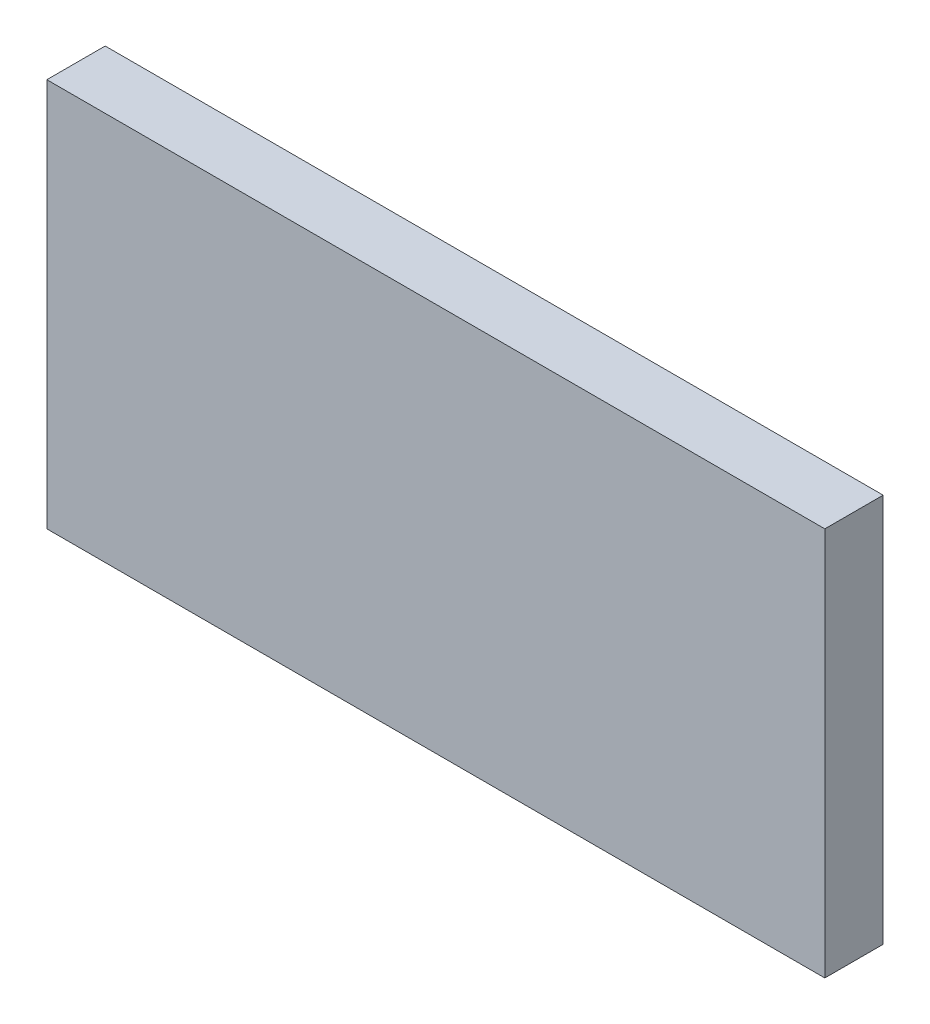
from build123d import *

# Parameters (mm, degrees)
SKETCH1_W           = 40
SKETCH1_H           = 20
BOSS_EXTRUDE1_DEPTH = 3


with BuildPart() as part:
    # Sketch1 → Boss-Extrude1 (new body)
    with BuildSketch(Plane.XY):
        with Locations((0.975582283, -1.204819277)):
            Rectangle(SKETCH1_W, SKETCH1_H)
    extrude(amount=BOSS_EXTRUDE1_DEPTH)


solid = part.part
